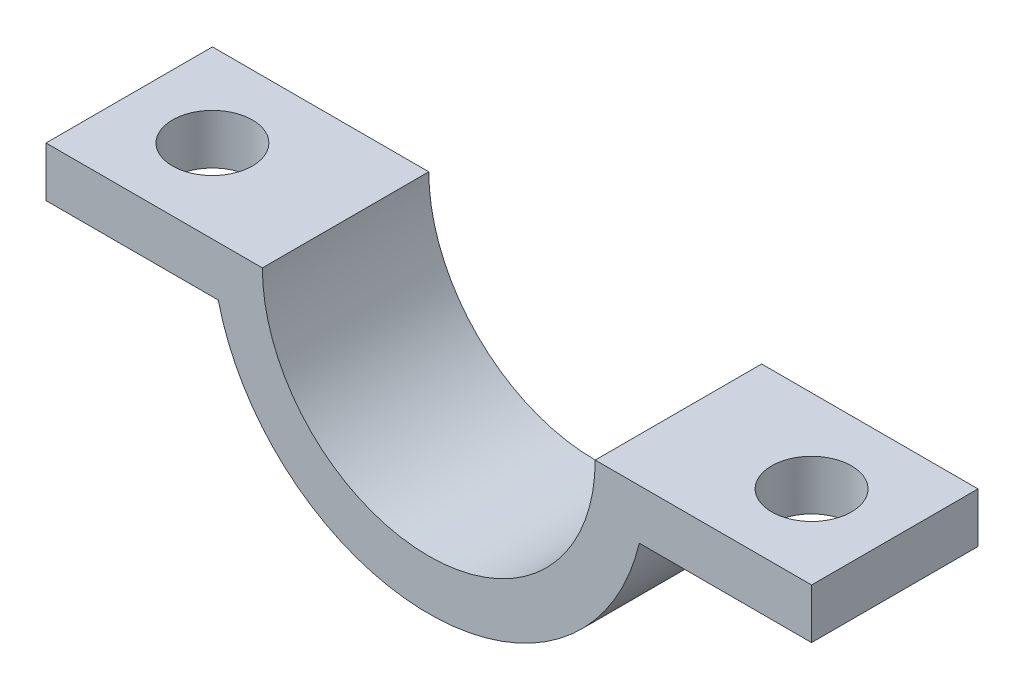
from build123d import *

# Parameters (mm, degrees)
BOSS_EXTRUDE1_DEPTH = 2.5
SKETCH2_R           = 1.2
CUT_EXTRUDE1_DEPTH  = 14.44432966


with BuildPart() as part:
    # Sketch1 → Boss-Extrude1 (new, symmetric)
    with BuildSketch(Plane.XY):
        with BuildLine():
            Line((5, 0), (11.5, 0))
            Line((11.5, 0), (11.5, -1.5))
            Line((11.5, -1.5), (6.32455532, -1.5))
            ThreePointArc((6.32455532, -1.5), (0, -6.5), (-6.32455532, -1.5))
            Line((-6.32455532, -1.5), (-11.5, -1.5))
            Line((-11.5, -1.5), (-11.5, 0))
            Line((-11.5, 0), (-5, 0))
            ThreePointArc((-5, 0), (0, -5), (5, 0))
        make_face()
    extrude(amount=BOSS_EXTRUDE1_DEPTH, both=True)

    # Sketch2 → Cut-Extrude1 (cut, through all)
    with BuildSketch(Plane(origin=(0, 0, 0), x_dir=(1, 0, 0), z_dir=(0, 1, 0))):
        with Locations(Location((-9, 0, 0), (0, 0, 270))):
            Circle(SKETCH2_R)
        with Locations(Location((9, 0, 0), (0, 0, 180))):
            Circle(SKETCH2_R)
    extrude(amount=-CUT_EXTRUDE1_DEPTH, mode=Mode.SUBTRACT)


solid = part.part
